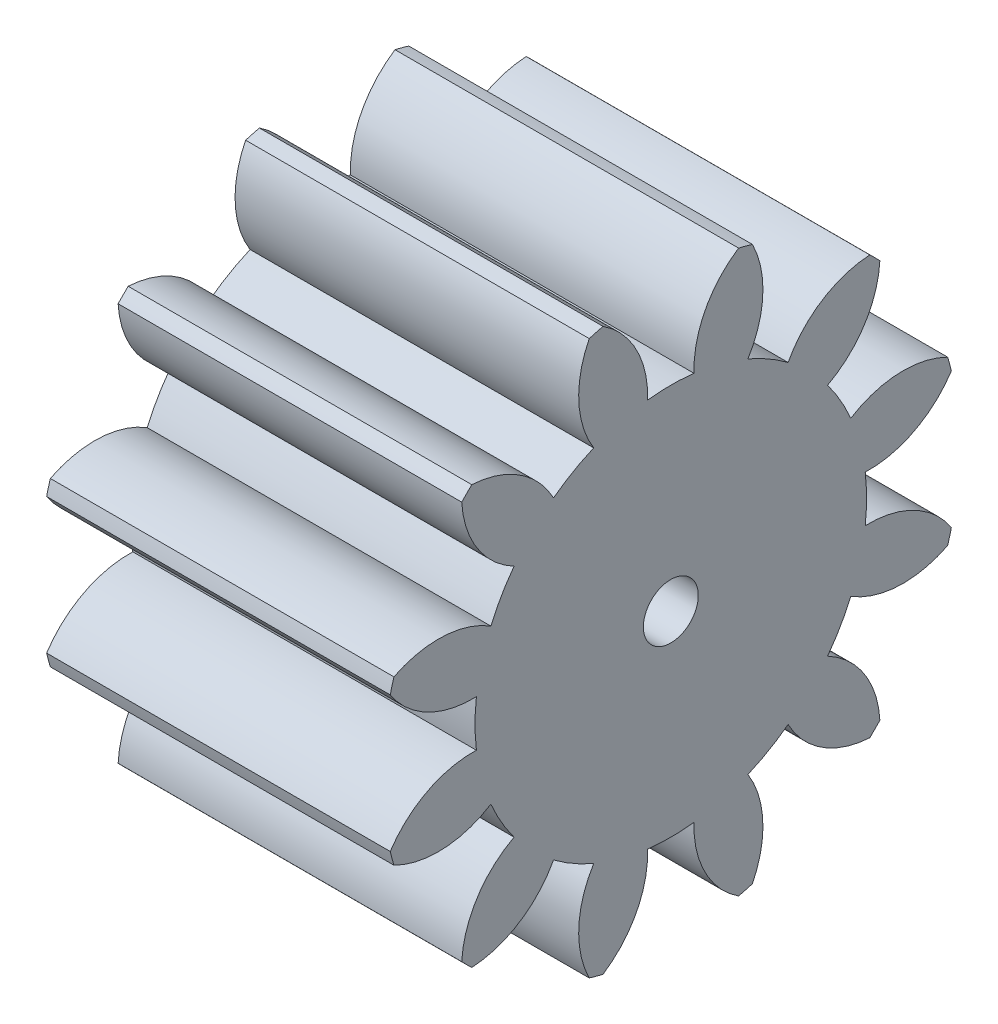
from build123d import *

# Parameters (mm, degrees)
BASPROSKE_W     = 5
BASPROSKE_H     = 4.2
TOOTHCUT_DEPTH  = 8.764019578
TEETHCUTS_COUNT = 12
TEETHCUTS_ANGLE = 330
BORSKE_R        = 0.4
BORE_DEPTH      = 50.0000508


with BuildPart() as part:
    # BasProSke → Base-Revolve (revolve)
    with BuildSketch(Plane(origin=(0, 0, 0), x_dir=(1, 0, 0), z_dir=(0, 1, 0)), mode=Mode.PRIVATE) as base_revolve_sk:
        with Locations((2.5, 2.1)):
            Rectangle(BASPROSKE_W, BASPROSKE_H)
    revolve(base_revolve_sk.sketch.rotate(Axis((-10, 0, 0), (1, 0, 0)), 180), axis=Axis((-10, 0, 0), (1, 0, 0)))

    # TooCutSke → ToothCut (cut, through all)
    with BuildSketch(Plane(origin=(0, 0, 0), x_dir=(0, 0, -1), z_dir=(1, 0, 0))):
        with BuildLine():
            ThreePointArc((0.337615381, 2.828925035), (0, 2.849), (-0.337615381, 2.828925035))
            ThreePointArc((-0.337615381, 2.828925035), (-0.506076789, 3.556215713), (-1.016063844, 4.101416758))
            ThreePointArc((-1.016063844, 4.101416758), (0, 4.2254), (1.016063844, 4.101416758))
            ThreePointArc((1.016063844, 4.101416758), (0.506076789, 3.556215713), (0.337615381, 2.828925035))
        make_face()
    toothcut = extrude(amount=TOOTHCUT_DEPTH, mode=Mode.SUBTRACT)

    # TeethCuts: ToothCut ×12 about axis
    teethcuts_axis = Axis((-10, 0, 0), (1, 0, 0))
    for i in range(1, TEETHCUTS_COUNT):
        add(toothcut.rotate(teethcuts_axis, i * TEETHCUTS_ANGLE / (TEETHCUTS_COUNT - 1)), mode=Mode.SUBTRACT)

    # BorSke → Bore (cut, symmetric)
    with BuildSketch(Plane(origin=(0, 0, 0), x_dir=(0, 0, -1), z_dir=(1, 0, 0))):
        with Locations(Location((0, 0, 0), (0, 0, 180))):
            Circle(BORSKE_R)
    extrude(amount=BORE_DEPTH, both=True, mode=Mode.SUBTRACT)


solid = part.part
